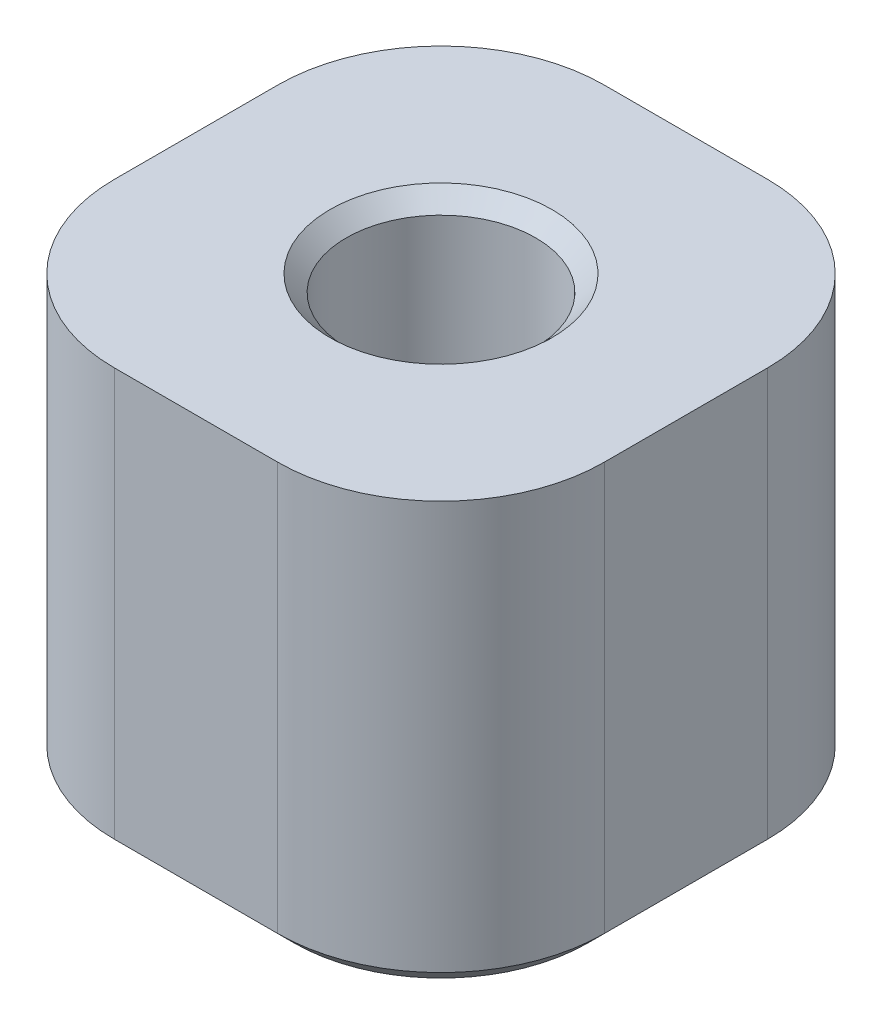
from build123d import *

# Parameters (mm, degrees)
SKETCH_1_W          = 30
SKETCH_1_H          = 30
EXTRUDE_1_DEPTH     = 26
SKETCH_2_R          = 5.8
CUT_EXTRUDE_1_DEPTH = 20
FILLET_1_R          = 10
CHAMFER_1_SIZE      = 1
CHAMFER_2_SIZE      = 1


with BuildPart() as part:
    # Эскиз1 → Бобышка-Вытянуть1 (new body)
    with BuildSketch(Plane(origin=(0, 0, 0), x_dir=(1, 0, 0), z_dir=(0, 1, 0))):
        Rectangle(SKETCH_1_W, SKETCH_1_H)
    extrude(amount=EXTRUDE_1_DEPTH)

    # Эскиз2 → Вырез-Вытянуть1 (cut)
    with BuildSketch(Plane(origin=(0, 26, 0), x_dir=(1, 0, 0), z_dir=(0, 1, 0))):
        with Locations(Location((0, 0, 0), (0, 0, 270))):
            Circle(SKETCH_2_R)
    extrude(amount=-CUT_EXTRUDE_1_DEPTH, mode=Mode.SUBTRACT)

    # Скругление1
    fillet_1_edges = [part.edges().sort_by_distance(p)[0] for p in [
        (15, 13, 15),
        (-15, 13, 15),
        (-15, 13, -15),
        (15, 13, -15),
    ]]
    fillet(fillet_1_edges, radius=FILLET_1_R)

    # Фаска1
    chamfer_1_edges = [part.edges().sort_by_distance(p)[0] for p in [
        (-15, 0, 0),
        (15, 0, 0),
        (0, 0, 15),
        (0, 0, -15),
        (12.071067812, 0, 12.071067812),
        (-12.071067812, 0, 12.071067812),
        (12.071067812, 0, -12.071067812),
        (-12.071067812, 0, -12.071067812),
    ]]
    chamfer(chamfer_1_edges, length=CHAMFER_1_SIZE)

    # Фаска2
    chamfer_2_edges = [part.edges().sort_by_distance(p)[0] for p in [
        (0, 26, -5.8),
    ]]
    chamfer(chamfer_2_edges, length=CHAMFER_2_SIZE)


solid = part.part
